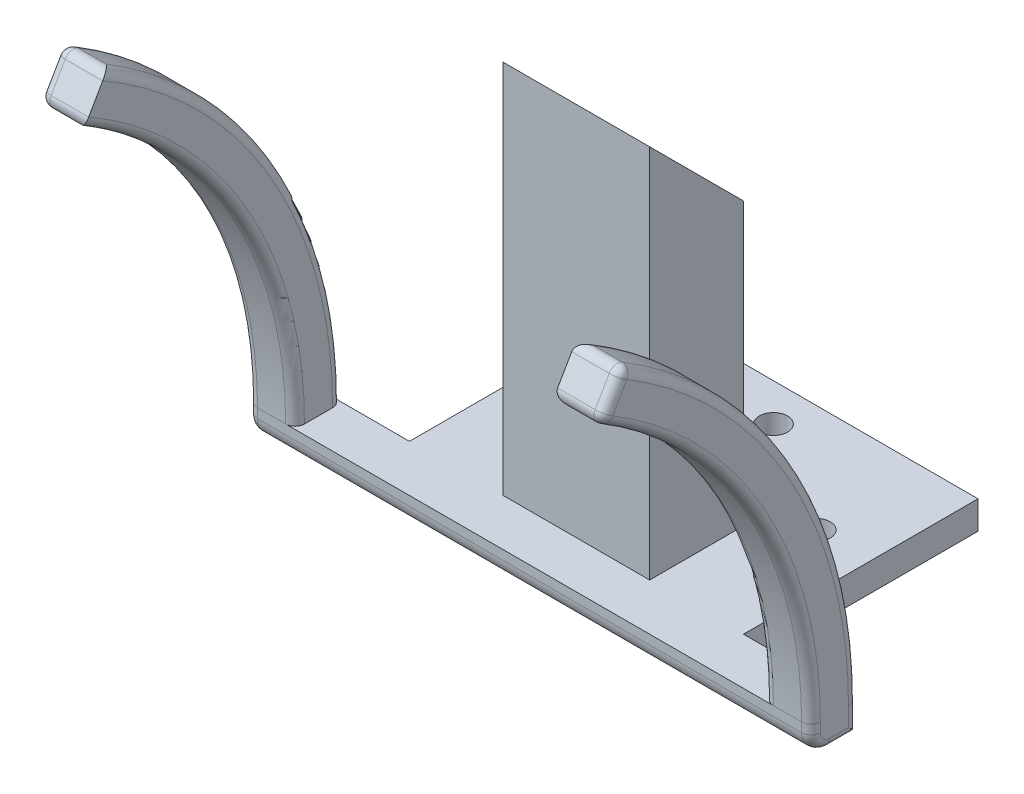
from build123d import *

# Parameters (mm, degrees)
SKETCH1_W           = 17.805
SKETCH1_H           = 25
BOSS_EXTRUDE1_DEPTH = 3
FILLET1_R           = 2
BOSS_EXTRUDE3_DEPTH = 5
FILLET2_R           = 1
FILLET3_R           = 1
SKETCH3_R           = 1.5
CUT_EXTRUDE1_DEPTH  = 5
SKETCH7_W           = 15.61
SKETCH7_H           = 10
BOSS_EXTRUDE4_DEPTH = 30
BOSS_EXTRUDE5_DEPTH = 15.61
SKETCH9_R           = 1.5
CUT_EXTRUDE2_DEPTH  = 5


with BuildPart() as part:
    # Sketch1 → Boss-Extrude1 (new body)
    with BuildSketch(Plane(origin=(0, 0, 0), x_dir=(1, 0, 0), z_dir=(0, 1, 0))):
        Polygon((9.368218391, -4.75), (-8.436781609, -4.75), (-26.241781609, -4.75), (-38.436781609, -4.75), (-38.436781609, -9.75), (21.563218391, -9.75), (21.563218391, -4.75), align=None)
        with Locations((0.465718391, 7.75)):
            Rectangle(SKETCH1_W, SKETCH1_H)
        with Locations((-17.339281609, 7.75)):
            Rectangle(SKETCH1_W, SKETCH1_H)
    extrude(amount=BOSS_EXTRUDE1_DEPTH)

    # Fillet1
    fillet1_edges = [part.edges().sort_by_distance(p)[0] for p in [
        (-8.436781609, 0, 9.75),
    ]]
    fillet(fillet1_edges, radius=FILLET1_R)

    # Sketch2 → Boss-Extrude3 (add)
    with BuildSketch(Plane(origin=(21.563218391, 0, 0), x_dir=(0, 0, -1), z_dir=(1, 0, 0))):
        with BuildLine():
            Line((-29.75, 46.301270189), (-32.25, 41.97114317))
            ThreePointArc((-32.25, 41.97114317), (-15.77885683, 25.5), (-9.75, 3))
            Line((-9.75, 3), (-4.75, 3))
            ThreePointArc((-4.75, 3), (-11.448729811, 28), (-29.75, 46.301270189))
        make_face()
    boss_extrude3 = extrude(amount=-BOSS_EXTRUDE3_DEPTH)

    # Fillet2
    fillet2_edges = [part.edges().sort_by_distance(p)[0] for p in [
        (21.563218391, 0, 6.25),
        (21.563218391, 2.5, 9.75),
        (21.563218391, 1.5, 4.75),
        (21.563218391, 0.585786438, 9.164213562),
        (16.563218391, 25.5, 15.77885683),
        (19.063218391, 41.97114317, 32.25),
        (16.563218391, 28, 11.448729811),
        (19.063218391, 46.301270189, 29.75),
        (21.563218391, 25.5, 15.77885683),
        (21.563218391, 28, 11.448729811),
        (21.563218391, 44.13620668, 31),
    ]]
    fillet(fillet2_edges, radius=FILLET2_R)

    # Mirror3: Boss-Extrude3 across plane
    add(boss_extrude3.mirror(Plane(origin=(-8.436781609, 0, 0), x_dir=(0, 0, 1), z_dir=(1, 0, 0))))

    # Fillet3
    fillet3_edges = [part.edges().sort_by_distance(p)[0] for p in [
        (-38.436781609, 0, 6.25),
        (-38.436781609, 2.5, 9.75),
        (-38.436781609, 1.5, 4.75),
        (-38.436781609, 0.585786438, 9.164213562),
        (-38.436781609, 25.5, 15.77885683),
        (-35.936781609, 41.97114317, 32.25),
        (-38.436781609, 28, 11.448729811),
        (-38.436781609, 44.13620668, 31),
        (-35.936781609, 46.301270189, 29.75),
        (-33.436781609, 25.5, 15.77885683),
        (-33.436781609, 28, 11.448729811),
    ]]
    fillet(fillet3_edges, radius=FILLET3_R)

    # Sketch3 → Cut-Extrude1 (cut)
    with BuildSketch(Plane.XZ):
        with Locations(Location((-20.484687418, -8.75, 0), (0, 0, 270))):
            Circle(SKETCH3_R)
        with Locations(Location((-8.434877213, -16.25, 0), (0, 0, 270))):
            Circle(SKETCH3_R)
        with Locations(Location((3.614932992, -8.75, 0), (0, 0, 270))):
            Circle(SKETCH3_R)
    extrude(amount=-CUT_EXTRUDE1_DEPTH, mode=Mode.SUBTRACT)

    # Sketch7 → Boss-Extrude4 (add)
    with BuildSketch(Plane(origin=(0, 3, 0), x_dir=(1, 0, 0), z_dir=(0, 1, 0))):
        with Locations((-8.436781609, 0.25)):
            Rectangle(SKETCH7_W, SKETCH7_H)
    extrude(amount=BOSS_EXTRUDE4_DEPTH)

    # Sketch8 → Boss-Extrude5 (add)
    with BuildSketch(Plane.ZY.offset(16.241781609)):
        Polygon((-5.25, 33), (4.75, 43), (4.75, 33), align=None)
    extrude(amount=-BOSS_EXTRUDE5_DEPTH)

    # Sketch9 → Cut-Extrude2 (cut)
    with BuildSketch(Plane(origin=(0, 19.125, -19.125), x_dir=(1, 0, 0), z_dir=(0, 0.7071067811865461, -0.7071067811865489))):
        with Locations(Location((-11.436781609, -26.69328099, 0), (0, 0, 270))):
            Circle(SKETCH9_R)
        with Locations(Location((-5.436781609, -26.69328099, 0), (0, 0, 270))):
            Circle(SKETCH9_R)
    extrude(amount=-CUT_EXTRUDE2_DEPTH, mode=Mode.SUBTRACT)


solid = part.part
